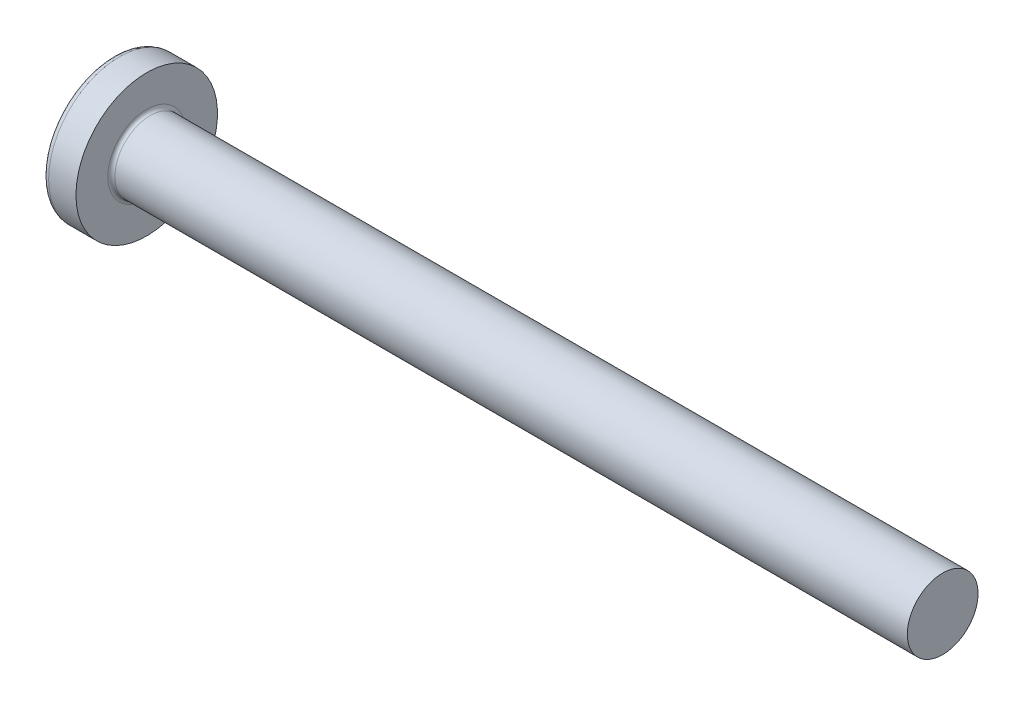
from build123d import *

# Parameters (mm, degrees)
FILLET1_R    = 0.2
RECPAT_COUNT = 2
RECPAT_ANGLE = 90


with BuildPart() as part:
    # BodySke → Base-Revolve (revolve)
    with BuildSketch(Plane.XY, mode=Mode.PRIVATE) as base_revolve_sk:
        with BuildLine():
            Line((3.1, 2), (3.1, 4))
            Line((3.1, 4), (1.555305874, 4))
            ThreePointArc((1.555305874, 4), (1.392873227, 3.961271902), (1.265388955, 3.853420195))
            ThreePointArc((1.265388955, 3.853420195), (0.324444487, 2.027933456), (0, 0))
            Line((0, 0), (48.1, 0))
            Line((48.1, 0), (48.1, 2))
            Line((48.1, 2), (3.1, 2))
        make_face()
    revolve(base_revolve_sk.sketch.rotate(Axis((1.555305874, 0, 0), (1, 0, 0)), 90), axis=Axis((1.555305874, 0, 0), (1, 0, 0)))

    # Fillet1
    fillet1_edges = [part.edges().sort_by_distance(p)[0] for p in [
        (3.1, 0, -2),
    ]]
    fillet(fillet1_edges, radius=FILLET1_R)

    # Sketch3 → Recess section 0
    with BuildSketch(Plane(origin=(0, 0, 0), x_dir=(0, 0, -1), z_dir=(1, 0, 0))):
        with BuildLine():
            Line((0.515, -2.15), (-0.515, -2.15))
            Line((-0.515, -2.15), (-0.515, 2.15))
            Line((-0.515, 2.15), (0.515, 2.15))
            Line((0.515, 2.15), (0.515, -2.15))
        make_face()
    # Sketch4 → Recess section 1
    with BuildSketch(Plane(origin=(2.34, 0, 0), x_dir=(0, 0, -1), z_dir=(1, 0, 0))):
        with BuildLine():
            Line((0.515, -0.983319232), (-0.515, -0.983319232))
            Line((-0.515, -0.983319232), (-0.515, 0.983319232))
            Line((-0.515, 0.983319232), (0.515, 0.983319232))
            Line((0.515, 0.983319232), (0.515, -0.983319232))
        make_face()
    recess = loft(mode=Mode.SUBTRACT)

    # RecPat: Recess ×2 about axis
    recpat_axis = Axis((0, 0, 0), (1, 0, 0))
    for i in range(1, RECPAT_COUNT):
        add(recess.rotate(recpat_axis, i * RECPAT_ANGLE / (RECPAT_COUNT - 1)), mode=Mode.SUBTRACT)

    # RecCorSke → RecessCore (revolve, cut)
    with BuildSketch(Plane.XY, mode=Mode.PRIVATE) as recesscore_sk:
        Polygon((0, 0), (0, 1.01462874), (2.34, 0.851), (2.616506661, 0), align=None)
    revolve(recesscore_sk.sketch.rotate(Axis((-3.175, 0, 0), (1, 0, 0)), 345.452408241), axis=Axis((-3.175, 0, 0), (1, 0, 0)), mode=Mode.SUBTRACT)


solid = part.part
